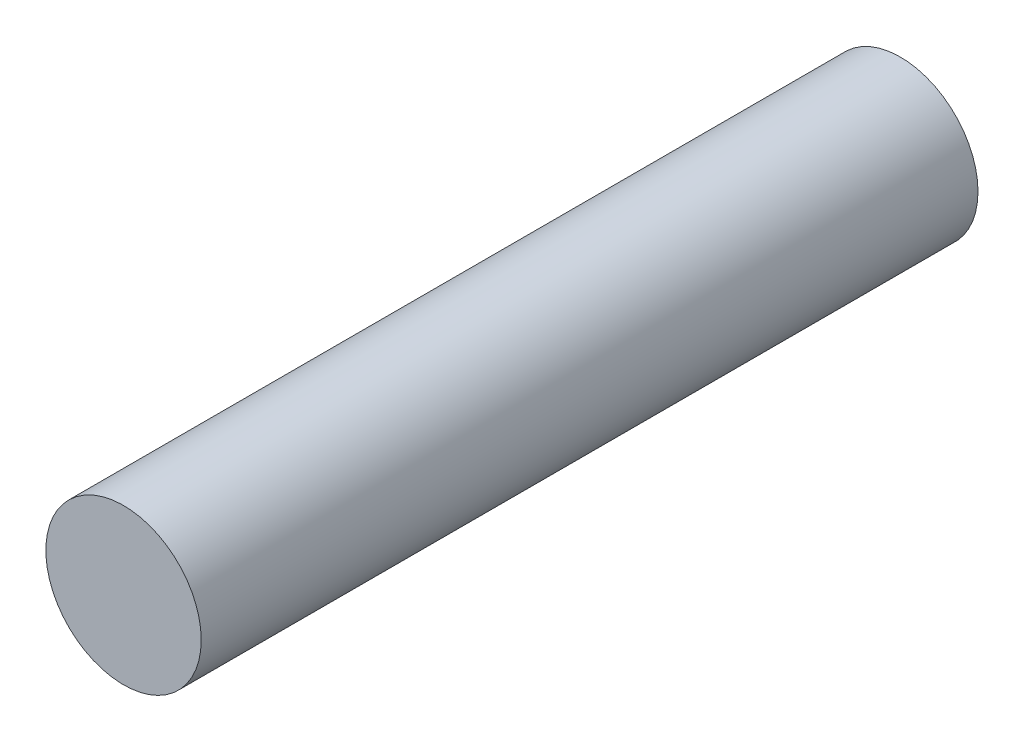
from build123d import *

# Parameters (mm, degrees)
ESQUISSE1_R        = 15
BOSS_EXTRU_1_DEPTH = 150


with BuildPart() as part:
    # Esquisse1 → Boss.-Extru.1 (new body)
    with BuildSketch(Plane.XY):
        Circle(ESQUISSE1_R)
    extrude(amount=BOSS_EXTRU_1_DEPTH)


solid = part.part
